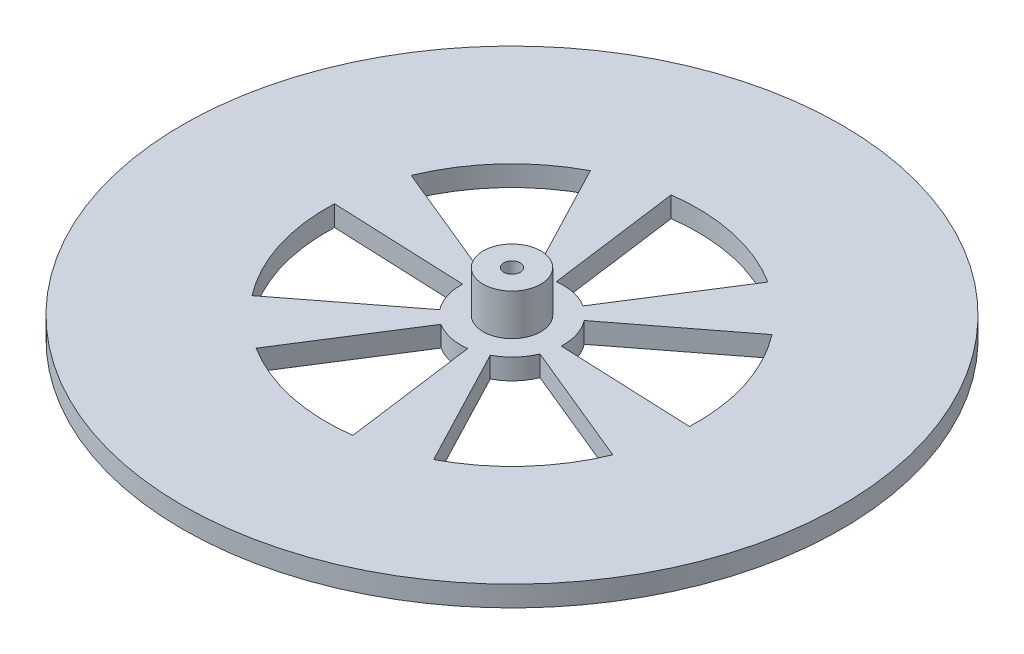
from build123d import *

# Parameters (mm, degrees)
SKETCH_1_R               = 80
EXTRUDE_1_DEPTH          = 5
CUT_EXTRUDE_3_DEPTH      = 114.247516529
PATTERN_CIRCULAR_2_COUNT = 6
SKETCH_2_R               = 7
SKETCH_2_R_2             = 2
EXTRUDE_2_DEPTH          = 10


with BuildPart() as part:
    # 草图1 → 凸台-拉伸1 (new body)
    with BuildSketch(Plane(origin=(0, 0, 0), x_dir=(1, 0, 0), z_dir=(0, 1, 0))):
        Circle(SKETCH_1_R)
    extrude(amount=EXTRUDE_1_DEPTH)

    # 草图5 → 切除-拉伸3 (cut, through all)
    with BuildSketch(Plane(origin=(0, 5, 0), x_dir=(1, 0, 0), z_dir=(0, 1, 0))):
        with BuildLine():
            Line((-41.607553791, 17.140929599), (-11.557653831, 4.761369333))
            ThreePointArc((-11.557653831, 4.761369333), (-9.232157797, 8.427174047), (-5.79312728, 11.076537199))
            Line((-5.79312728, 11.076537199), (-20.855258209, 39.875533916))
            ThreePointArc((-20.855258209, 39.875533916), (-33.235768068, 30.337826569), (-41.607553791, 17.140929599))
        make_face()
    cut_extrude_3 = extrude(amount=-CUT_EXTRUDE_3_DEPTH, mode=Mode.SUBTRACT)

    # 阵列(圆周)2: 切除-拉伸3 ×6 about axis
    pattern_circular_2_axis = Axis((0, 5, 0), (0, 1, 0))
    for i in range(1, PATTERN_CIRCULAR_2_COUNT):
        add(cut_extrude_3.rotate(pattern_circular_2_axis, i * 360 / PATTERN_CIRCULAR_2_COUNT), mode=Mode.SUBTRACT)

    # 草图2 → 凸台-拉伸2 (add)
    with BuildSketch(Plane(origin=(0, 5, 0), x_dir=(1, 0, 0), z_dir=(0, 1, 0))):
        Circle(SKETCH_2_R)
        Circle(SKETCH_2_R_2, mode=Mode.SUBTRACT)
    extrude(amount=EXTRUDE_2_DEPTH)


solid = part.part
